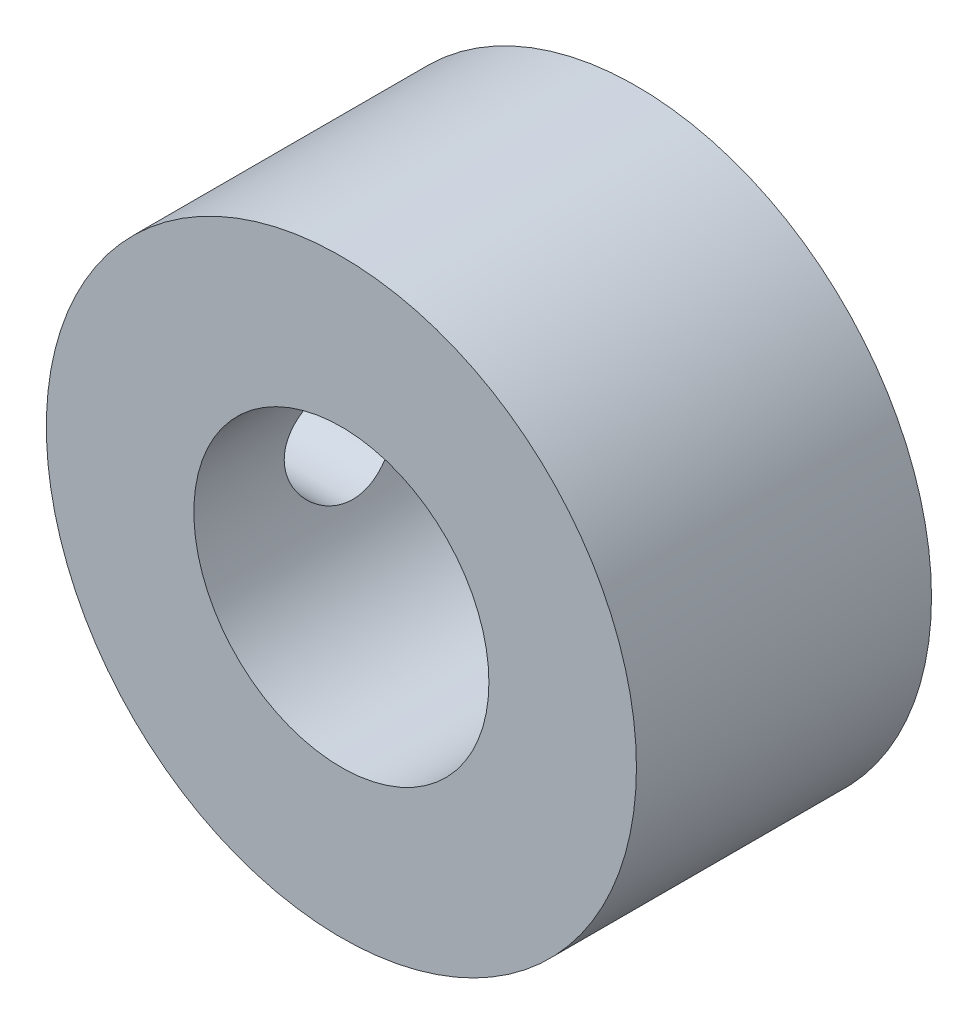
from build123d import *

# Parameters (mm, degrees)
SKETCH1_R               = 8
SKETCH1_R_2             = 4
BOSS_EXTRUDE1_DEPTH     = 8
CUT_EXTRUDE1_REACH      = 15.856
CUT_EXTRUDE1_END_RADIUS = 8
SKETCH2_R               = 1.55


with BuildPart() as part:
    # Sketch1 → Boss-Extrude1 (new body)
    with BuildSketch(Plane.XY):
        Circle(SKETCH1_R)
        Circle(SKETCH1_R_2, mode=Mode.SUBTRACT)
    extrude(amount=BOSS_EXTRUDE1_DEPTH)

    # Cut-Extrude1: up to this cylinder (the profile starts inside it)
    cut_extrude1_end = Plane(origin=(0, 0, 4), z_dir=(0, 0, -1)) * Cylinder(CUT_EXTRUDE1_END_RADIUS, 48.712, mode=Mode.PRIVATE)
    # Sketch2 → Cut-Extrude1 (cut, up to the surface)
    with BuildSketch(Plane(origin=(0, 0, 0), x_dir=(0, 0, -1), z_dir=(1, 0, 0)), mode=Mode.PRIVATE) as cut_extrude1_sk1:
        with Locations((-4, 0)):
            Circle(SKETCH2_R)
    cut_extrude1_tool1 = extrude(cut_extrude1_sk1.sketch, amount=-CUT_EXTRUDE1_REACH, mode=Mode.PRIVATE) & cut_extrude1_end
    add(cut_extrude1_tool1.solids().sort_by_distance((0, 0, 4))[0], mode=Mode.SUBTRACT)


solid = part.part
